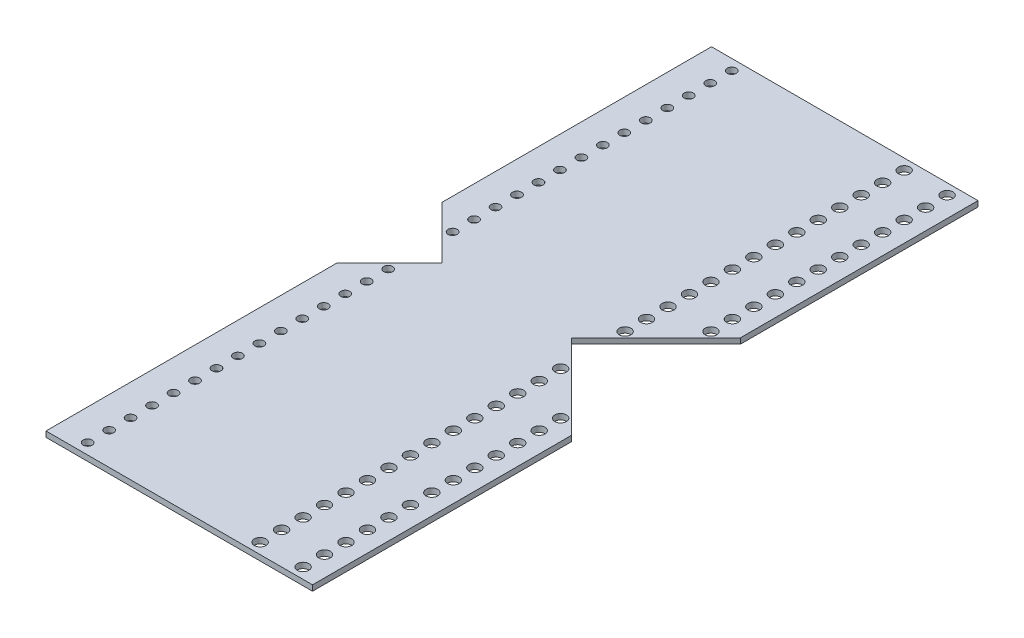
from build123d import *

# Parameters (mm, degrees)
SKETCH1_W           = 76.609890536
SKETCH1_H           = 190.5
SKETCH1_R           = 2.667
SKETCH1_R_2         = 3.436543353
BOSS_EXTRUDE1_DEPTH = 3.302


with BuildPart() as part:
    # Sketch1 → Boss-Extrude1 (new body)
    # profile 1 of 6: a face of its own
    with BuildSketch(Plane(origin=(0, 0, 0), x_dir=(1, 0, 0), z_dir=(0, 1, 0))):
        with Locations((-44.02898095, 106.210707771)):
            Rectangle(SKETCH1_W, SKETCH1_H)
    # profile 2 of 6: a face of its own
    with BuildSketch(Plane(origin=(0, 0, 0), x_dir=(1, 0, 0), z_dir=(0, 1, 0))):
        Polygon((-82.432035682, -192.239292229), (-5.724035682, -192.239292229), (-5.724035682, 10.960707771), (-82.333926218, 10.960707771), (-82.432035682, 10.862598307), align=None)
    # profile 3 of 6: a face of its own
    with BuildSketch(Plane(origin=(0, 0, 0), x_dir=(1, 0, 0), z_dir=(0, 1, 0))):
        Polygon((-113.420035682, -192.239292229), (-82.432035682, -192.239292229), (-82.432035682, 10.862598307), (-113.420035682, -20.125401693), align=None)
        with Locations(Location((-95.132035682, -185.889292229, 0), (0, 0, 90))):
            Circle(SKETCH1_R, mode=Mode.SUBTRACT)
        with Locations(Location((-95.132035682, -173.189292229, 0), (0, 0, 90))):
            Circle(SKETCH1_R, mode=Mode.SUBTRACT)
        with Locations(Location((-95.132035682, -160.489292229, 0), (0, 0, 90))):
            Circle(SKETCH1_R, mode=Mode.SUBTRACT)
        with Locations(Location((-95.132035682, -147.789292229, 0), (0, 0, 90))):
            Circle(SKETCH1_R, mode=Mode.SUBTRACT)
        with Locations(Location((-95.132035682, -135.089292229, 0), (0, 0, 90))):
            Circle(SKETCH1_R, mode=Mode.SUBTRACT)
        with Locations(Location((-95.132035682, -122.389292229, 0), (0, 0, 90))):
            Circle(SKETCH1_R, mode=Mode.SUBTRACT)
        with Locations(Location((-95.132035682, -109.689292229, 0), (0, 0, 90))):
            Circle(SKETCH1_R, mode=Mode.SUBTRACT)
        with Locations(Location((-95.132035682, -96.989292229, 0), (0, 0, 90))):
            Circle(SKETCH1_R, mode=Mode.SUBTRACT)
        with Locations(Location((-95.132035682, -84.289292229, 0), (0, 0, 90))):
            Circle(SKETCH1_R, mode=Mode.SUBTRACT)
        with Locations(Location((-95.132035682, -71.589292229, 0), (0, 0, 90))):
            Circle(SKETCH1_R, mode=Mode.SUBTRACT)
        with Locations(Location((-95.132035682, -58.889292229, 0), (0, 0, 90))):
            Circle(SKETCH1_R, mode=Mode.SUBTRACT)
        with Locations(Location((-95.132035682, -46.189292229, 0), (0, 0, 90))):
            Circle(SKETCH1_R, mode=Mode.SUBTRACT)
        with Locations(Location((-95.132035682, -33.489292229, 0), (0, 0, 90))):
            Circle(SKETCH1_R, mode=Mode.SUBTRACT)
        with Locations(Location((-95.132035682, -20.789292229, 0), (0, 0, 90))):
            Circle(SKETCH1_R, mode=Mode.SUBTRACT)
        with Locations(Location((-95.132035682, -8.089292229, 0), (0, 0, 90))):
            Circle(SKETCH1_R, mode=Mode.SUBTRACT)
    # profile 4 of 6: a face of its own
    with BuildSketch(Plane(origin=(0, 0, 0), x_dir=(1, 0, 0), z_dir=(0, 1, 0))):
        Polygon((44.242948133, -192.239292229), (44.242948133, -38.991111119), (-5.708870757, 10.960707771), (-5.724035682, 10.960707771), (-5.724035682, -192.239292229), align=None)
        with Locations(Location((6.904948133, -185.889292229, 0), (0, 0, 90))):
            Circle(SKETCH1_R_2, mode=Mode.SUBTRACT)
        with Locations(Location((6.904948133, -173.189292229, 0), (0, 0, 90))):
            Circle(SKETCH1_R_2, mode=Mode.SUBTRACT)
        with Locations(Location((6.904948133, -160.489292229, 0), (0, 0, 90))):
            Circle(SKETCH1_R_2, mode=Mode.SUBTRACT)
        with Locations(Location((6.904948133, -147.789292229, 0), (0, 0, 90))):
            Circle(SKETCH1_R_2, mode=Mode.SUBTRACT)
        with Locations(Location((32.304948133, -185.889292229, 0), (0, 0, 90))):
            Circle(SKETCH1_R_2, mode=Mode.SUBTRACT)
        with Locations(Location((32.304948133, -173.189292229, 0), (0, 0, 90))):
            Circle(SKETCH1_R_2, mode=Mode.SUBTRACT)
        with Locations(Location((32.304948133, -160.489292229, 0), (0, 0, 90))):
            Circle(SKETCH1_R_2, mode=Mode.SUBTRACT)
        with Locations(Location((32.304948133, -147.789292229, 0), (0, 0, 90))):
            Circle(SKETCH1_R_2, mode=Mode.SUBTRACT)
        with Locations(Location((6.904948133, -135.089292229, 0), (0, 0, 90))):
            Circle(SKETCH1_R_2, mode=Mode.SUBTRACT)
        with Locations(Location((6.904948133, -122.389292229, 0), (0, 0, 90))):
            Circle(SKETCH1_R_2, mode=Mode.SUBTRACT)
        with Locations(Location((6.904948133, -109.689292229, 0), (0, 0, 90))):
            Circle(SKETCH1_R_2, mode=Mode.SUBTRACT)
        with Locations(Location((6.904948133, -96.989292229, 0), (0, 0, 90))):
            Circle(SKETCH1_R_2, mode=Mode.SUBTRACT)
        with Locations(Location((32.304948133, -135.089292229, 0), (0, 0, 90))):
            Circle(SKETCH1_R_2, mode=Mode.SUBTRACT)
        with Locations(Location((32.304948133, -122.389292229, 0), (0, 0, 90))):
            Circle(SKETCH1_R_2, mode=Mode.SUBTRACT)
        with Locations(Location((32.304948133, -109.689292229, 0), (0, 0, 90))):
            Circle(SKETCH1_R_2, mode=Mode.SUBTRACT)
        with Locations(Location((32.304948133, -96.989292229, 0), (0, 0, 90))):
            Circle(SKETCH1_R_2, mode=Mode.SUBTRACT)
        with Locations(Location((6.904948133, -84.289292229, 0), (0, 0, 90))):
            Circle(SKETCH1_R_2, mode=Mode.SUBTRACT)
        with Locations(Location((6.904948133, -71.589292229, 0), (0, 0, 90))):
            Circle(SKETCH1_R_2, mode=Mode.SUBTRACT)
        with Locations(Location((6.904948133, -58.889292229, 0), (0, 0, 90))):
            Circle(SKETCH1_R_2, mode=Mode.SUBTRACT)
        with Locations(Location((6.904948133, -46.189292229, 0), (0, 0, 90))):
            Circle(SKETCH1_R_2, mode=Mode.SUBTRACT)
        with Locations(Location((32.304948133, -84.289292229, 0), (0, 0, 90))):
            Circle(SKETCH1_R_2, mode=Mode.SUBTRACT)
        with Locations(Location((32.304948133, -71.589292229, 0), (0, 0, 90))):
            Circle(SKETCH1_R_2, mode=Mode.SUBTRACT)
        with Locations(Location((32.304948133, -58.889292229, 0), (0, 0, 90))):
            Circle(SKETCH1_R_2, mode=Mode.SUBTRACT)
        with Locations(Location((32.304948133, -46.189292229, 0), (0, 0, 90))):
            Circle(SKETCH1_R_2, mode=Mode.SUBTRACT)
        with Locations(Location((6.904948133, -33.489292229, 0), (0, 0, 90))):
            Circle(SKETCH1_R_2, mode=Mode.SUBTRACT)
        with Locations(Location((6.904948133, -20.789292229, 0), (0, 0, 90))):
            Circle(SKETCH1_R_2, mode=Mode.SUBTRACT)
        with Locations(Location((6.904948133, -8.089292229, 0), (0, 0, 90))):
            Circle(SKETCH1_R_2, mode=Mode.SUBTRACT)
        with Locations(Location((32.304948133, -33.489292229, 0), (0, 0, 90))):
            Circle(SKETCH1_R_2, mode=Mode.SUBTRACT)
    # profile 5 of 6: a face of its own
    with BuildSketch(Plane(origin=(0, 0, 0), x_dir=(1, 0, 0), z_dir=(0, 1, 0))):
        Polygon((-5.724035682, 10.960707771), (-5.708870757, 10.960707771), (44.242948133, 60.912526661), (44.242948133, 201.460707771), (-5.724035682, 201.460707771), align=None)
        with Locations(Location((6.904948133, 30.010707771, 0), (0, 0, 90))):
            Circle(SKETCH1_R_2, mode=Mode.SUBTRACT)
        with Locations(Location((6.904948133, 42.710707771, 0), (0, 0, 90))):
            Circle(SKETCH1_R_2, mode=Mode.SUBTRACT)
        with Locations(Location((6.904948133, 55.410707771, 0), (0, 0, 90))):
            Circle(SKETCH1_R_2, mode=Mode.SUBTRACT)
        with Locations(Location((6.904948133, 68.110707771, 0), (0, 0, 90))):
            Circle(SKETCH1_R_2, mode=Mode.SUBTRACT)
        with Locations(Location((6.904948133, 80.810707771, 0), (0, 0, 90))):
            Circle(SKETCH1_R_2, mode=Mode.SUBTRACT)
        with Locations(Location((6.904948133, 93.510707771, 0), (0, 0, 90))):
            Circle(SKETCH1_R_2, mode=Mode.SUBTRACT)
        with Locations(Location((32.304948133, 55.410707771, 0), (0, 0, 90))):
            Circle(SKETCH1_R_2, mode=Mode.SUBTRACT)
        with Locations(Location((32.304948133, 68.110707771, 0), (0, 0, 90))):
            Circle(SKETCH1_R_2, mode=Mode.SUBTRACT)
        with Locations(Location((32.304948133, 80.810707771, 0), (0, 0, 90))):
            Circle(SKETCH1_R_2, mode=Mode.SUBTRACT)
        with Locations(Location((32.304948133, 93.510707771, 0), (0, 0, 90))):
            Circle(SKETCH1_R_2, mode=Mode.SUBTRACT)
        with Locations(Location((6.904948133, 106.210707771, 0), (0, 0, 90))):
            Circle(SKETCH1_R_2, mode=Mode.SUBTRACT)
        with Locations(Location((6.904948133, 118.910707771, 0), (0, 0, 90))):
            Circle(SKETCH1_R_2, mode=Mode.SUBTRACT)
        with Locations(Location((6.904948133, 131.610707771, 0), (0, 0, 90))):
            Circle(SKETCH1_R_2, mode=Mode.SUBTRACT)
        with Locations(Location((6.904948133, 144.310707771, 0), (0, 0, 90))):
            Circle(SKETCH1_R_2, mode=Mode.SUBTRACT)
        with Locations(Location((32.304948133, 106.210707771, 0), (0, 0, 90))):
            Circle(SKETCH1_R_2, mode=Mode.SUBTRACT)
        with Locations(Location((32.304948133, 118.910707771, 0), (0, 0, 90))):
            Circle(SKETCH1_R_2, mode=Mode.SUBTRACT)
        with Locations(Location((32.304948133, 131.610707771, 0), (0, 0, 90))):
            Circle(SKETCH1_R_2, mode=Mode.SUBTRACT)
        with Locations(Location((32.304948133, 144.310707771, 0), (0, 0, 90))):
            Circle(SKETCH1_R_2, mode=Mode.SUBTRACT)
        with Locations(Location((6.904948133, 157.010707771, 0), (0, 0, 90))):
            Circle(SKETCH1_R_2, mode=Mode.SUBTRACT)
        with Locations(Location((6.904948133, 169.710707771, 0), (0, 0, 90))):
            Circle(SKETCH1_R_2, mode=Mode.SUBTRACT)
        with Locations(Location((6.904948133, 182.410707771, 0), (0, 0, 90))):
            Circle(SKETCH1_R_2, mode=Mode.SUBTRACT)
        with Locations(Location((6.904948133, 195.110707771, 0), (0, 0, 90))):
            Circle(SKETCH1_R_2, mode=Mode.SUBTRACT)
        with Locations(Location((32.304948133, 157.010707771, 0), (0, 0, 90))):
            Circle(SKETCH1_R_2, mode=Mode.SUBTRACT)
        with Locations(Location((32.304948133, 169.710707771, 0), (0, 0, 90))):
            Circle(SKETCH1_R_2, mode=Mode.SUBTRACT)
        with Locations(Location((32.304948133, 182.410707771, 0), (0, 0, 90))):
            Circle(SKETCH1_R_2, mode=Mode.SUBTRACT)
        with Locations(Location((32.304948133, 195.110707771, 0), (0, 0, 90))):
            Circle(SKETCH1_R_2, mode=Mode.SUBTRACT)
    # profile 6 of 6: a face of its own
    with BuildSketch(Plane(origin=(0, 0, 0), x_dir=(1, 0, 0), z_dir=(0, 1, 0))):
        Polygon((-82.333926218, 10.960707771), (-113.420035682, 42.046817234), (-113.420035682, 201.460707771), (-82.333926218, 201.460707771), align=None)
        with Locations(Location((-95.132035682, 30.010707771, 0), (0, 0, 90))):
            Circle(SKETCH1_R, mode=Mode.SUBTRACT)
        with Locations(Location((-95.132035682, 42.710707771, 0), (0, 0, 90))):
            Circle(SKETCH1_R, mode=Mode.SUBTRACT)
        with Locations(Location((-95.132035682, 55.410707771, 0), (0, 0, 90))):
            Circle(SKETCH1_R, mode=Mode.SUBTRACT)
        with Locations(Location((-95.132035682, 68.110707771, 0), (0, 0, 90))):
            Circle(SKETCH1_R, mode=Mode.SUBTRACT)
        with Locations(Location((-95.132035682, 80.810707771, 0), (0, 0, 90))):
            Circle(SKETCH1_R, mode=Mode.SUBTRACT)
        with Locations(Location((-95.132035682, 93.510707771, 0), (0, 0, 90))):
            Circle(SKETCH1_R, mode=Mode.SUBTRACT)
        with Locations(Location((-95.132035682, 106.210707771, 0), (0, 0, 90))):
            Circle(SKETCH1_R, mode=Mode.SUBTRACT)
        with Locations(Location((-95.132035682, 118.910707771, 0), (0, 0, 90))):
            Circle(SKETCH1_R, mode=Mode.SUBTRACT)
        with Locations(Location((-95.132035682, 131.610707771, 0), (0, 0, 90))):
            Circle(SKETCH1_R, mode=Mode.SUBTRACT)
        with Locations(Location((-95.132035682, 144.310707771, 0), (0, 0, 90))):
            Circle(SKETCH1_R, mode=Mode.SUBTRACT)
        with Locations(Location((-95.132035682, 157.010707771, 0), (0, 0, 90))):
            Circle(SKETCH1_R, mode=Mode.SUBTRACT)
        with Locations(Location((-95.132035682, 169.710707771, 0), (0, 0, 90))):
            Circle(SKETCH1_R, mode=Mode.SUBTRACT)
        with Locations(Location((-95.132035682, 182.410707771, 0), (0, 0, 90))):
            Circle(SKETCH1_R, mode=Mode.SUBTRACT)
        with Locations(Location((-95.132035682, 195.110707771, 0), (0, 0, 90))):
            Circle(SKETCH1_R, mode=Mode.SUBTRACT)
    extrude(amount=BOSS_EXTRUDE1_DEPTH)


solid = part.part
